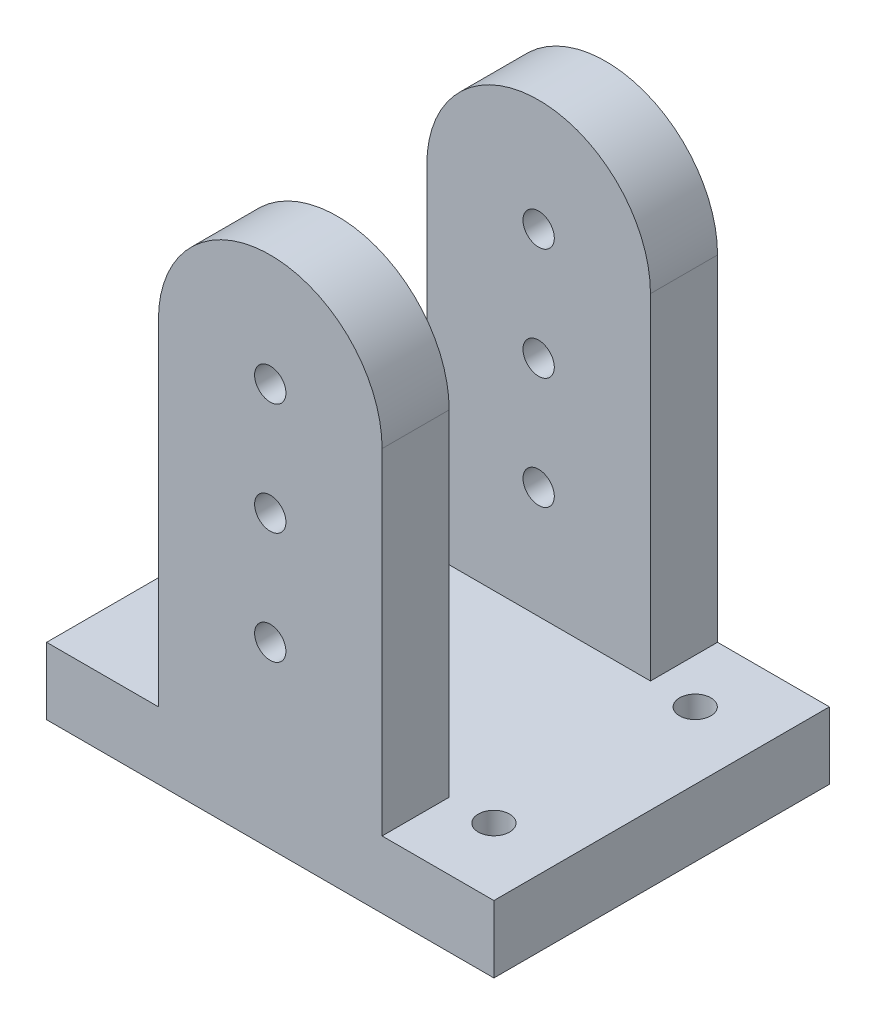
from build123d import *

# Parameters (mm, degrees)
SKETCH3_R               = 1.778
BOSS_EXTRUDE2_DEPTH     = 38.1
CUT_EXTRUDE3_DEPTH      = 65.707715151
CUT_EXTRUDE3_DEPTH_BACK = 65.707715151
SKETCH11_W              = 22.86
SKETCH11_H              = 50.8
SKETCH8_R               = 1.778
CUT_EXTRUDE4_DEPTH      = 65.707715151


with BuildPart() as part:
    # Sketch3 → Boss-Extrude2 (new body)
    with BuildSketch(Plane.XY):
        with BuildLine():
            Line((12.7, -38.1), (25.4, -38.1))
            Line((25.4, -38.1), (25.4, -45.72))
            Line((25.4, -45.72), (-25.4, -45.72))
            Line((-25.4, -45.72), (-25.4, -38.1))
            Line((-25.4, -38.1), (-12.7, -38.1))
            Line((-12.7, -38.1), (-12.7, 0))
            ThreePointArc((-12.7, 0), (0, 12.7), (12.7, 0))
            Line((12.7, 0), (12.7, -38.1))
        make_face()
        with Locations(Location((0, 0, 0), (0, 0, 180))):
            Circle(SKETCH3_R, mode=Mode.SUBTRACT)
        with Locations(Location((0, -12.7, 0), (0, 0, 180))):
            Circle(SKETCH3_R, mode=Mode.SUBTRACT)
        with Locations(Location((0, -25.4, 0), (0, 0, 180))):
            Circle(SKETCH3_R, mode=Mode.SUBTRACT)
    extrude(amount=BOSS_EXTRUDE2_DEPTH)

    # Sketch11 → Cut-Extrude3 (cut, two sides: drawn at the far end of the back side and taken through both)
    with BuildSketch(Plane(origin=(0, 0, 0), x_dir=(0, 0, -1), z_dir=(1, 0, 0)).offset(-CUT_EXTRUDE3_DEPTH_BACK)):
        with Locations((-19.05, -12.7)):
            Rectangle(SKETCH11_W, SKETCH11_H)
    extrude(amount=CUT_EXTRUDE3_DEPTH + CUT_EXTRUDE3_DEPTH_BACK, mode=Mode.SUBTRACT)

    # Sketch8 → Cut-Extrude4 (cut, through all)
    with BuildSketch(Plane(origin=(0, 0, 0), x_dir=(1, 0, 0), z_dir=(0, 1, 0))):
        with Locations(Location((-17.78, -7.62, 0), (0, 0, 270))):
            Circle(SKETCH8_R)
        with Locations(Location((17.78, -7.62, 0), (0, 0, 270))):
            Circle(SKETCH8_R)
        with Locations(Location((17.78, -30.48, 0), (0, 0, 270))):
            Circle(SKETCH8_R)
        with Locations(Location((-17.78, -30.48, 0), (0, 0, 270))):
            Circle(SKETCH8_R)
    extrude(amount=-CUT_EXTRUDE4_DEPTH, mode=Mode.SUBTRACT)


solid = part.part
